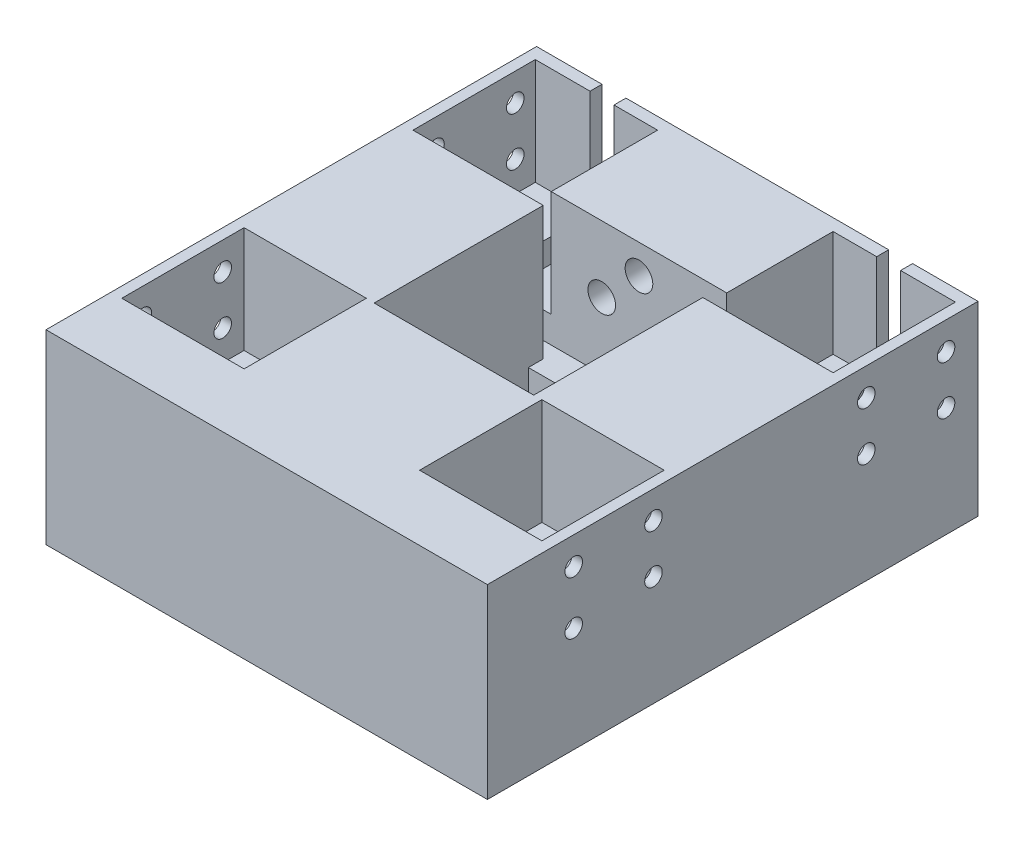
from build123d import *

# Parameters (mm, degrees)
SKETCH2_W           = 83
SKETCH2_H           = 80
BOSS_EXTRUDE1_DEPTH = 35
SKETCH3_W           = 23
SKETCH3_H           = 23
CUT_EXTRUDE1_DEPTH  = 20
CUT_EXTRUDE11_REACH = 98.881
SKETCH21_R          = 1.65
CUT_EXTRUDE3_REACH  = 69.433
SKETCH8_W           = 15
SKETCH8_H           = 29
SKETCH10_R          = 3.35
CUT_EXTRUDE4_DEPTH  = 12
SKETCH11_W          = 83
SKETCH11_H          = 35
BOSS_EXTRUDE2_DEPTH = 2.25
SKETCH24_W          = 58.39763532
SKETCH24_H          = 3
CUT_EXTRUDE13_DEPTH = 25
SKETCH25_W          = 30
SKETCH25_H          = 3.363441727
CUT_EXTRUDE14_DEPTH = 25
CUT_EXTRUDE15_REACH = 70.792
SKETCH28_W          = 4.5
SKETCH28_H          = 22.250000153
FILLET2_R           = 2
SKETCH29_R          = 2.6
CUT_EXTRUDE16_DEPTH = 8
SKETCH30_R          = 2.6
CUT_EXTRUDE17_DEPTH = 8
SKETCH32_W          = 83
SKETCH32_H          = 35
BOSS_EXTRUDE5_DEPTH = 10


with BuildPart() as part:
    # Sketch2 → Boss-Extrude1 (new body)
    with BuildSketch(Plane(origin=(0, 0, 0), x_dir=(1, 0, 0), z_dir=(0, 1, 0))):
        Rectangle(SKETCH2_W, SKETCH2_H)
    extrude(amount=BOSS_EXTRUDE1_DEPTH)

    # Sketch3 → Cut-Extrude1 (cut)
    with BuildSketch(Plane(origin=(0, 35, 0), x_dir=(1, 0, 0), z_dir=(0, 1, 0))):
        with Locations((28, -26.254632213)):
            Rectangle(SKETCH3_W, SKETCH3_H)
        with Locations((28, 28.5)):
            Rectangle(SKETCH3_W, SKETCH3_H)
    cut_extrude1 = extrude(amount=-CUT_EXTRUDE1_DEPTH, mode=Mode.SUBTRACT)

    # Sketch21 → Cut-Extrude11 (cut, up to next)
    with BuildSketch(Plane.ZY.offset(-39.5), mode=Mode.PRIVATE) as cut_extrude11_sk1:
        with Locations((-36.241596758, 29.796951458)):
            Circle(SKETCH21_R)
    cut_extrude11_tool1 = extrude(cut_extrude11_sk1.sketch, amount=-CUT_EXTRUDE11_REACH, mode=Mode.PRIVATE) & part.part
    # Sketch21 → Cut-Extrude11 (cut, up to next)
    with BuildSketch(Plane.ZY.offset(-39.5), mode=Mode.PRIVATE) as cut_extrude11_sk2:
        with Locations((-36.241596399, 20.666302449)):
            Circle(SKETCH21_R)
    cut_extrude11_tool2 = extrude(cut_extrude11_sk2.sketch, amount=-CUT_EXTRUDE11_REACH, mode=Mode.PRIVATE) & part.part
    # Sketch21 → Cut-Extrude11 (cut, up to next)
    with BuildSketch(Plane.ZY.offset(-39.5), mode=Mode.PRIVATE) as cut_extrude11_sk3:
        with Locations((-21.24159988, 29.796951458)):
            Circle(SKETCH21_R)
    cut_extrude11_tool3 = extrude(cut_extrude11_sk3.sketch, amount=-CUT_EXTRUDE11_REACH, mode=Mode.PRIVATE) & part.part
    # Sketch21 → Cut-Extrude11 (cut, up to next)
    with BuildSketch(Plane.ZY.offset(-39.5), mode=Mode.PRIVATE) as cut_extrude11_sk4:
        with Locations((-21.24159988, 20.666302449)):
            Circle(SKETCH21_R)
    cut_extrude11_tool4 = extrude(cut_extrude11_sk4.sketch, amount=-CUT_EXTRUDE11_REACH, mode=Mode.PRIVATE) & part.part
    # Sketch21 → Cut-Extrude11 (cut, up to next)
    with BuildSketch(Plane.ZY.offset(-39.5), mode=Mode.PRIVATE) as cut_extrude11_sk5:
        with Locations((18.771463682, 29.796951458)):
            Circle(SKETCH21_R)
    cut_extrude11_tool5 = extrude(cut_extrude11_sk5.sketch, amount=-CUT_EXTRUDE11_REACH, mode=Mode.PRIVATE) & part.part
    # Sketch21 → Cut-Extrude11 (cut, up to next)
    with BuildSketch(Plane.ZY.offset(-39.5), mode=Mode.PRIVATE) as cut_extrude11_sk6:
        with Locations((33.771463682, 29.796951458)):
            Circle(SKETCH21_R)
    cut_extrude11_tool6 = extrude(cut_extrude11_sk6.sketch, amount=-CUT_EXTRUDE11_REACH, mode=Mode.PRIVATE) & part.part
    # Sketch21 → Cut-Extrude11 (cut, up to next)
    with BuildSketch(Plane.ZY.offset(-39.5), mode=Mode.PRIVATE) as cut_extrude11_sk7:
        with Locations((33.771463682, 19.796951458)):
            Circle(SKETCH21_R)
    cut_extrude11_tool7 = extrude(cut_extrude11_sk7.sketch, amount=-CUT_EXTRUDE11_REACH, mode=Mode.PRIVATE) & part.part
    # Sketch21 → Cut-Extrude11 (cut, up to next)
    with BuildSketch(Plane.ZY.offset(-39.5), mode=Mode.PRIVATE) as cut_extrude11_sk8:
        with Locations((18.771463682, 20.666302449)):
            Circle(SKETCH21_R)
    cut_extrude11_tool8 = extrude(cut_extrude11_sk8.sketch, amount=-CUT_EXTRUDE11_REACH, mode=Mode.PRIVATE) & part.part
    cut_extrude11_1 = cut_extrude11_tool1.solids().sort_by_distance((39.5, 29.796951, -36.241597))[0]
    add(cut_extrude11_1, mode=Mode.SUBTRACT)
    cut_extrude11_2 = cut_extrude11_tool2.solids().sort_by_distance((39.5, 20.666302, -36.241596))[0]
    add(cut_extrude11_2, mode=Mode.SUBTRACT)
    cut_extrude11_3 = cut_extrude11_tool3.solids().sort_by_distance((39.5, 29.796951, -21.2416))[0]
    add(cut_extrude11_3, mode=Mode.SUBTRACT)
    cut_extrude11_4 = cut_extrude11_tool4.solids().sort_by_distance((39.5, 20.666302, -21.2416))[0]
    add(cut_extrude11_4, mode=Mode.SUBTRACT)
    cut_extrude11_5 = cut_extrude11_tool5.solids().sort_by_distance((39.5, 29.796951, 18.771464))[0]
    add(cut_extrude11_5, mode=Mode.SUBTRACT)
    cut_extrude11_6 = cut_extrude11_tool6.solids().sort_by_distance((39.5, 29.796951, 33.771464))[0]
    add(cut_extrude11_6, mode=Mode.SUBTRACT)
    cut_extrude11_7 = cut_extrude11_tool7.solids().sort_by_distance((39.5, 19.796951, 33.771464))[0]
    add(cut_extrude11_7, mode=Mode.SUBTRACT)
    cut_extrude11_8 = cut_extrude11_tool8.solids().sort_by_distance((39.5, 20.666302, 18.771464))[0]
    add(cut_extrude11_8, mode=Mode.SUBTRACT)
    cut_extrude11 = cut_extrude11_1 + cut_extrude11_2 + cut_extrude11_3 + cut_extrude11_4 + cut_extrude11_5 + cut_extrude11_6 + cut_extrude11_7 + cut_extrude11_8  # Cut-Extrude11 as one shape, for the pattern or mirror that repeats it

    # Sketch8 → Cut-Extrude3 (cut, up to next)
    with BuildSketch(Plane(origin=(0, 35, 0), x_dir=(1, 0, 0), z_dir=(0, 1, 0)), mode=Mode.PRIVATE) as cut_extrude3_sk1:
        with Locations((-7.5, -0.300000153)):
            Rectangle(SKETCH8_W, SKETCH8_H)
    cut_extrude3_tool1 = extrude(cut_extrude3_sk1.sketch, amount=-CUT_EXTRUDE3_REACH, mode=Mode.PRIVATE) & part.part
    # Sketch8 → Cut-Extrude3 (cut, up to next)
    with BuildSketch(Plane(origin=(0, 35, 0), x_dir=(1, 0, 0), z_dir=(0, 1, 0)), mode=Mode.PRIVATE) as cut_extrude3_sk2:
        with Locations((7.5, -0.300000153)):
            Rectangle(SKETCH8_W, SKETCH8_H)
    cut_extrude3_tool2 = extrude(cut_extrude3_sk2.sketch, amount=-CUT_EXTRUDE3_REACH, mode=Mode.PRIVATE) & part.part
    add(cut_extrude3_tool1.solids().sort_by_distance((-7.5, 35, 0.3))[0], mode=Mode.SUBTRACT)
    add(cut_extrude3_tool2.solids().sort_by_distance((7.5, 35, 0.3))[0], mode=Mode.SUBTRACT)

    # Sketch10 → Cut-Extrude4 (cut)
    with BuildSketch(Plane.ZY.offset(-15)):
        with Locations((8.800000153, 30)):
            Circle(SKETCH10_R)
        with Locations((8.800000153, 5)):
            Circle(SKETCH10_R)
        with Locations((-7.199999847, 5)):
            Circle(SKETCH10_R)
        with Locations((-7.199999847, 30)):
            Circle(SKETCH10_R)
    extrude(amount=-CUT_EXTRUDE4_DEPTH, mode=Mode.SUBTRACT)

    # Sketch11 → Boss-Extrude2 (add)
    with BuildSketch(Plane(origin=(0, 0, -40), x_dir=(-1, 0, 0), z_dir=(0, 0, -1))):
        with Locations((0, 17.5)):
            Rectangle(SKETCH11_W, SKETCH11_H)
    extrude(amount=BOSS_EXTRUDE2_DEPTH)

    # Mirror1: Cut-Extrude1, Cut-Extrude11 across plane
    add(cut_extrude1.mirror(Plane(origin=(0, 0, 0), x_dir=(0, 0, 1), z_dir=(1, 0, 0))), mode=Mode.SUBTRACT)
    add(cut_extrude11.mirror(Plane(origin=(0, 0, 0), x_dir=(0, 0, 1), z_dir=(1, 0, 0))), mode=Mode.SUBTRACT)

    # Sketch24 → Cut-Extrude13 (cut)
    with BuildSketch(Plane(origin=(0, 35, 0), x_dir=(1, 0, 0), z_dir=(0, 1, 0))):
        with Locations((0, 18.499999847)):
            Rectangle(SKETCH24_W, SKETCH24_H)
    extrude(amount=-CUT_EXTRUDE13_DEPTH, mode=Mode.SUBTRACT)

    # Sketch25 → Cut-Extrude14 (cut)
    with BuildSketch(Plane(origin=(0, 35, 0), x_dir=(1, 0, 0), z_dir=(0, 1, 0))):
        with Locations((0, 15.881720711)):
            Rectangle(SKETCH25_W, SKETCH25_H)
    extrude(amount=-CUT_EXTRUDE14_DEPTH, mode=Mode.SUBTRACT)

    # Cut-Extrude15: up to this face of the body (flat: up to its plane)
    cut_extrude15_end = Plane(part.part.faces().sort_by_distance((0, 10, -17.560159309))[0])
    # Sketch28 → Cut-Extrude15 (cut, up to the picked face)
    with BuildSketch(Plane(origin=(0, 35, 0), x_dir=(1, 0, 0), z_dir=(0, 1, 0)), mode=Mode.PRIVATE) as cut_extrude15_sk1:
        with Locations((-26.94881766, 31.124999923)):
            Rectangle(SKETCH28_W, SKETCH28_H)
    cut_extrude15_tool1 = split(extrude(cut_extrude15_sk1.sketch, amount=-CUT_EXTRUDE15_REACH, mode=Mode.PRIVATE), bisect_by=cut_extrude15_end, keep=Keep.BOTH, mode=Mode.PRIVATE)
    # Sketch28 → Cut-Extrude15 (cut, up to the picked face)
    with BuildSketch(Plane(origin=(0, 35, 0), x_dir=(1, 0, 0), z_dir=(0, 1, 0)), mode=Mode.PRIVATE) as cut_extrude15_sk2:
        with Locations((26.94881766, 31.124999923)):
            Rectangle(SKETCH28_W, SKETCH28_H)
    cut_extrude15_tool2 = split(extrude(cut_extrude15_sk2.sketch, amount=-CUT_EXTRUDE15_REACH, mode=Mode.PRIVATE), bisect_by=cut_extrude15_end, keep=Keep.BOTH, mode=Mode.PRIVATE)
    add(cut_extrude15_tool1.solids().sort_by(Axis((-26.948818, 35, -31.125), (0, -1, 0)))[0], mode=Mode.SUBTRACT)
    add(cut_extrude15_tool2.solids().sort_by(Axis((26.948818, 35, -31.125), (0, -1, 0)))[0], mode=Mode.SUBTRACT)

    # Fillet2
    fillet2_edges = [part.edges().sort_by_distance(p)[0] for p in [
        (-24.69881766, 12.5, -19.999999847),
        (24.69881766, 12.5, -19.999999847),
    ]]
    fillet(fillet2_edges, radius=FILLET2_R)

    # Sketch29 → Cut-Extrude16 (cut)
    with BuildSketch(Plane.XY.offset(-19.999999847)):
        with Locations((0, 29.5)):
            Circle(SKETCH29_R)
        with Locations((-7, 22.5)):
            Circle(SKETCH29_R)
        with Locations((7, 22.5)):
            Circle(SKETCH29_R)
        with Locations((0, 15.5)):
            Circle(SKETCH29_R)
    extrude(amount=-CUT_EXTRUDE16_DEPTH, mode=Mode.SUBTRACT)

    # Sketch30 → Cut-Extrude17 (cut)
    with BuildSketch(Plane(origin=(0, 0, -17), x_dir=(-1, 0, 0), z_dir=(0, 0, -1))):
        with Locations((-18.6, 22.5)):
            Circle(SKETCH30_R)
        with Locations((18.6, 22.5)):
            Circle(SKETCH30_R)
    extrude(amount=-CUT_EXTRUDE17_DEPTH, mode=Mode.SUBTRACT)

    # Sketch32 → Boss-Extrude5 (add)
    with BuildSketch(Plane.XY.offset(40)):
        with Locations((0, 17.5)):
            Rectangle(SKETCH32_W, SKETCH32_H)
    extrude(amount=BOSS_EXTRUDE5_DEPTH)


solid = part.part
